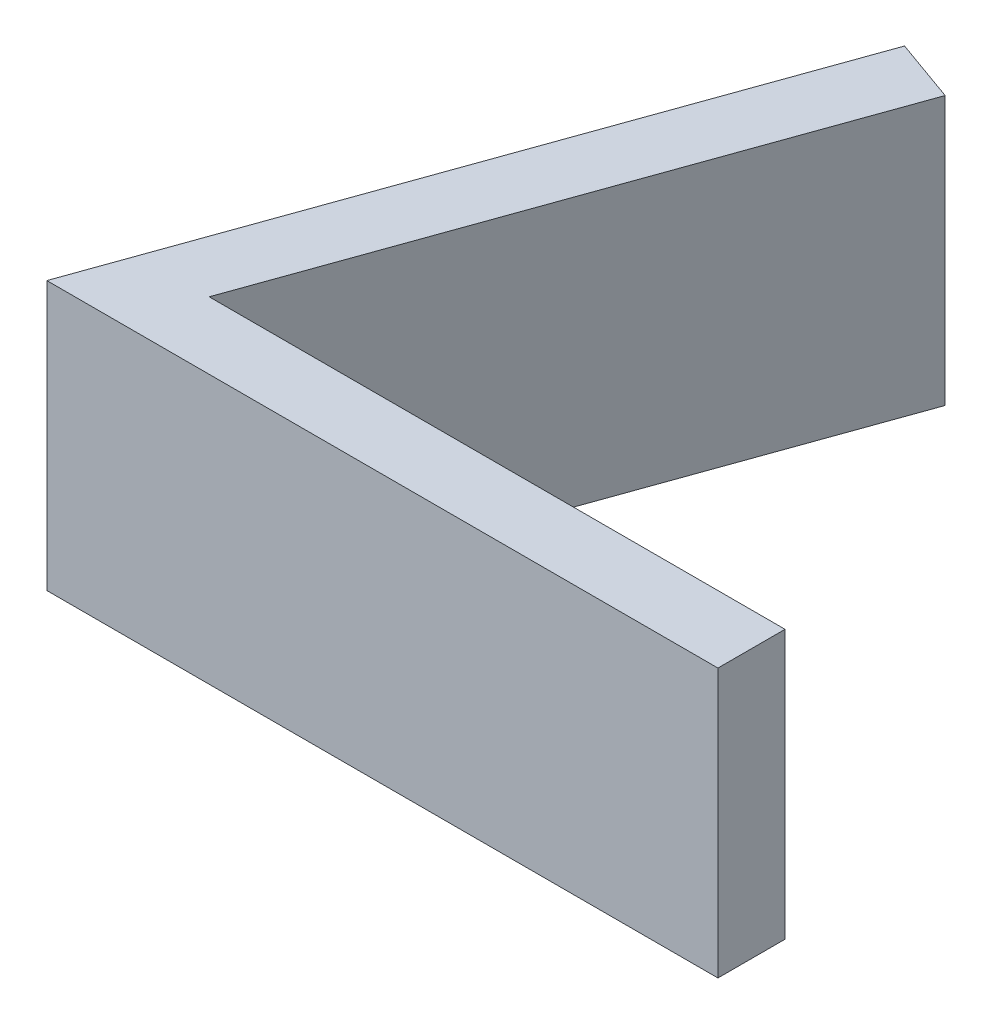
from build123d import *

# Parameters (mm, degrees)
BOSS_EXTRUDE1_DEPTH = 20


with BuildPart() as part:
    # Sketch1 → Boss-Extrude1 (new body)
    with BuildSketch(Plane(origin=(0, 0, 0), x_dir=(1, 0, 0), z_dir=(0, 1, 0))):
        Polygon((0, 0), (12.679677005, 0), (12.679677005, 5), (-30.225298437, 5), (-15.794793554, 45.405413579), (-20.503503111, 47.087095567), (-37.320322995, 0), align=None)
    extrude(amount=BOSS_EXTRUDE1_DEPTH)


solid = part.part
